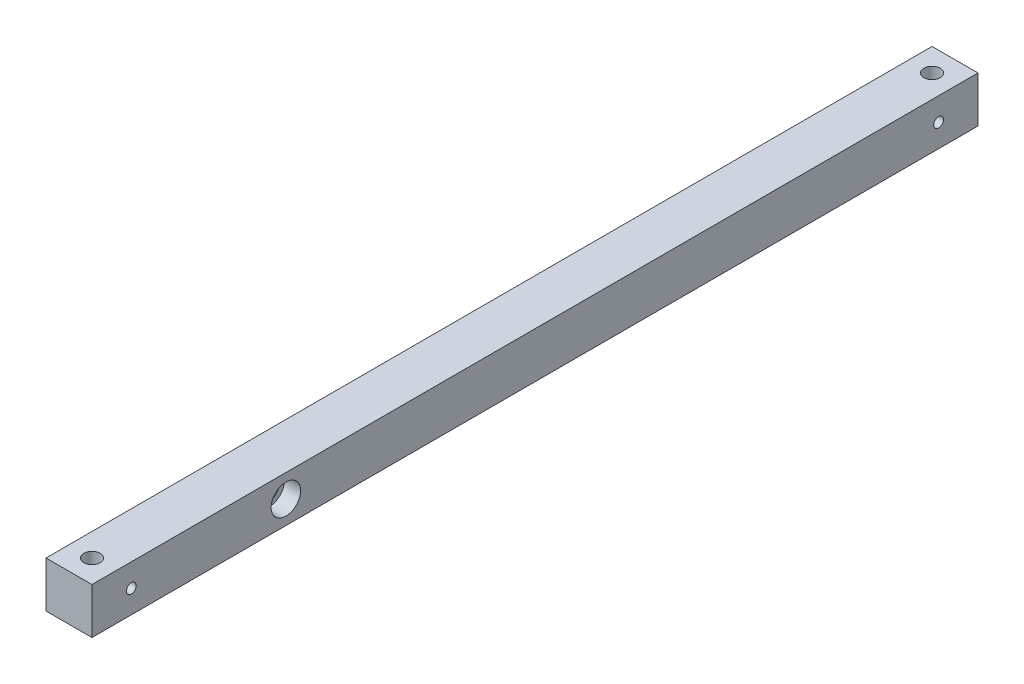
from build123d import *

# Parameters (mm, degrees)
IZIM1_W                     = 28
IZIM1_H                     = 28
Y_KSEKLIK_EKSTR_ZYON1_DEPTH = 270
IZIM3_R                     = 5
KES_EKSTR_ZYON2_DEPTH       = 7
IZIM4_R                     = 3
KES_EKSTR_ZYON3_DEPTH       = 272.808756298
IZIM5_R                     = 6
KES_EKSTR_ZYON4_DEPTH       = 272.808756298
IZIM6_R                     = 9
KES_EKSTR_ZYON5_DEPTH       = 10
KES_EKSTR_ZYON6_REACH       = 273.809
IZIM7_R                     = 3
IZIM9_R                     = 5
KES_EKSTR_ZYON8_DEPTH       = 7
SKETCH2_R                   = 3
CUT_EXTRUDE1_DEPTH          = 16
SKETCH3_R                   = 6
CUT_EXTRUDE2_DEPTH          = 20
SKETCH4_R                   = 2.5
CUT_EXTRUDE3_DEPTH          = 10


with BuildPart() as part:
    # Çizim1 → Yükseklik-Ekstrüzyon1 (new, symmetric)
    with BuildSketch(Plane.XY):
        Rectangle(IZIM1_W, IZIM1_H)
    extrude(amount=Y_KSEKLIK_EKSTR_ZYON1_DEPTH, both=True)

    # Çizim3 → Kes-Ekstrüzyon2 (cut)
    with BuildSketch(Plane(origin=(0, 14, 0), x_dir=(1, 0, 0), z_dir=(0, 1, 0))):
        with Locations(Location((0, 256, 0), (0, 0, 270))):
            Circle(IZIM3_R)
        with Locations(Location((0, -256, 0), (0, 0, 270))):
            Circle(IZIM3_R)
    extrude(amount=-KES_EKSTR_ZYON2_DEPTH, mode=Mode.SUBTRACT)

    # Çizim4 → Kes-Ekstrüzyon3 (cut, through all)
    with BuildSketch(Plane(origin=(0, 14, 0), x_dir=(1, 0, 0), z_dir=(0, 1, 0))):
        with Locations(Location((0, -256, 0), (0, 0, 270))):
            Circle(IZIM4_R)
        with Locations(Location((0, 256, 0), (0, 0, 270))):
            Circle(IZIM4_R)
    extrude(amount=-KES_EKSTR_ZYON3_DEPTH, mode=Mode.SUBTRACT)

    # Çizim5 → Kes-Ekstrüzyon4 (cut, through all)
    with BuildSketch(Plane(origin=(14, 0, 0), x_dir=(0, 0, -1), z_dir=(1, 0, 0))):
        with Locations((-151.8, 0)):
            Circle(IZIM5_R)
    extrude(amount=-KES_EKSTR_ZYON4_DEPTH, mode=Mode.SUBTRACT)

    # Çizim6 → Kes-Ekstrüzyon5 (cut)
    with BuildSketch(Plane(origin=(14, 0, 0), x_dir=(0, 0, -1), z_dir=(1, 0, 0))):
        with Locations((-151.8, 0)):
            Circle(IZIM6_R)
    extrude(amount=-KES_EKSTR_ZYON5_DEPTH, mode=Mode.SUBTRACT)

    # Çizim7 → Kes-Ekstrüzyon6 (cut, up to next)
    with BuildSketch(Plane(origin=(14, 0, 0), x_dir=(0, 0, -1), z_dir=(1, 0, 0)), mode=Mode.PRIVATE) as kes_ekstr_zyon6_sk1:
        with Locations((246, 0)):
            Circle(IZIM7_R)
    kes_ekstr_zyon6_tool1 = extrude(kes_ekstr_zyon6_sk1.sketch, amount=-KES_EKSTR_ZYON6_REACH, mode=Mode.PRIVATE) & part.part
    # Çizim7 → Kes-Ekstrüzyon6 (cut, up to next)
    with BuildSketch(Plane(origin=(14, 0, 0), x_dir=(0, 0, -1), z_dir=(1, 0, 0)), mode=Mode.PRIVATE) as kes_ekstr_zyon6_sk2:
        with Locations((-246, 0)):
            Circle(IZIM7_R)
    kes_ekstr_zyon6_tool2 = extrude(kes_ekstr_zyon6_sk2.sketch, amount=-KES_EKSTR_ZYON6_REACH, mode=Mode.PRIVATE) & part.part
    add(kes_ekstr_zyon6_tool1.solids().sort_by_distance((14, 0, -246))[0], mode=Mode.SUBTRACT)
    add(kes_ekstr_zyon6_tool2.solids().sort_by_distance((14, 0, 246))[0], mode=Mode.SUBTRACT)

    # Çizim9 → Kes-Ekstrüzyon8 (cut)
    with BuildSketch(Plane.ZY.offset(14)):
        with Locations((246, 0)):
            Circle(IZIM9_R)
        with Locations((-246, 0)):
            Circle(IZIM9_R)
    extrude(amount=-KES_EKSTR_ZYON8_DEPTH, mode=Mode.SUBTRACT)

    # Sketch2 → Cut-Extrude1 (cut)
    with BuildSketch(Plane.XZ.offset(14)):
        with Locations(Location((0, 193.8, 0), (0, 0, 270))):
            Circle(SKETCH2_R)
        with Locations(Location((0, 106.8, 0), (0, 0, 270))):
            Circle(SKETCH2_R)
    extrude(amount=-CUT_EXTRUDE1_DEPTH, mode=Mode.SUBTRACT)

    # Sketch3 → Cut-Extrude2 (cut)
    with BuildSketch(Plane.ZY.offset(14)):
        with Locations((116.8, 0)):
            Circle(SKETCH3_R)
    extrude(amount=-CUT_EXTRUDE2_DEPTH, mode=Mode.SUBTRACT)

    # Sketch4 → Cut-Extrude3 (cut)
    with BuildSketch(Plane.XZ.offset(14)):
        with Locations(Location((-2, 116.8, 0), (0, 0, 270))):
            Circle(SKETCH4_R)
    extrude(amount=-CUT_EXTRUDE3_DEPTH, mode=Mode.SUBTRACT)


solid = part.part
